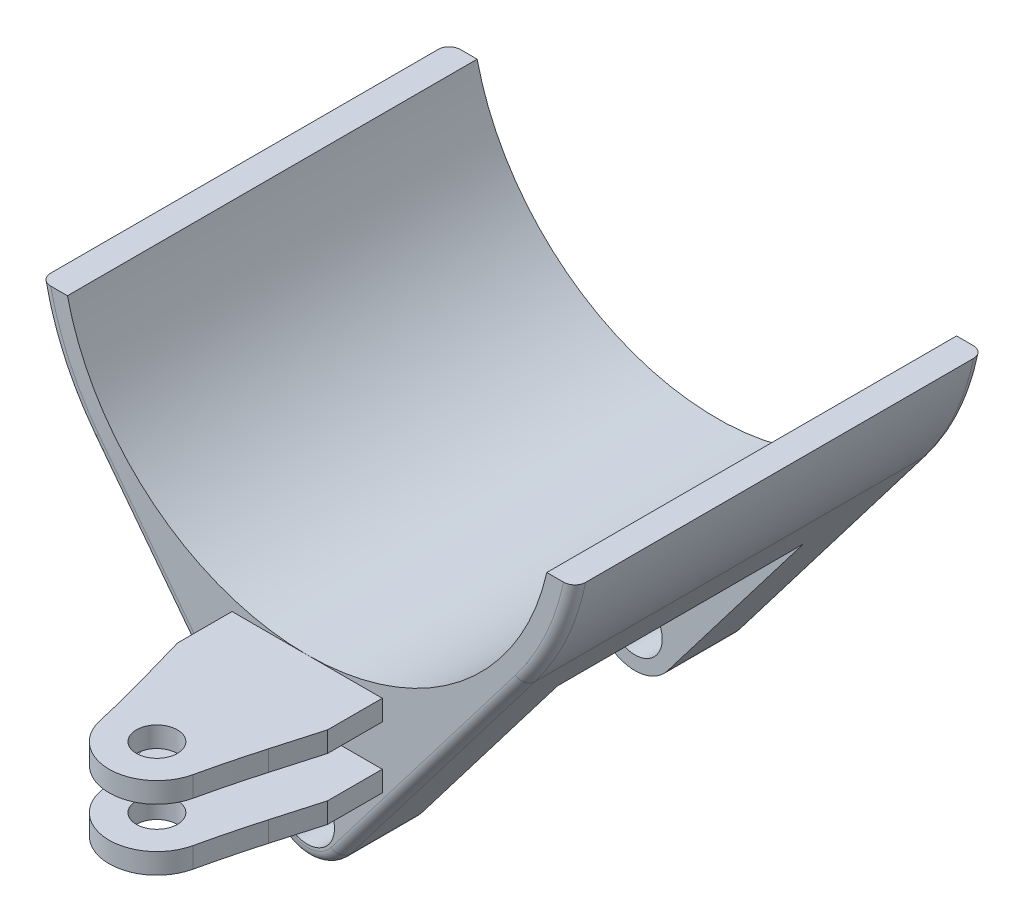
from build123d import *

# Parameters (mm, degrees)
SKETCH1_R             = 20
BOSS_EXTRUDE1_DEPTH   = 150
BOSS_EXTRUDE2_START   = 40
SKETCH2_R             = 15
BOSS_EXTRUDE2_DEPTH   = 60
SKETCH3_W             = 178.732333714
SKETCH3_H             = 30
CUT_EXTRUDE1_DEPTH    = 150
SKETCH4_W             = 180
SKETCH4_H             = 180.454063709
CUT_EXTRUDE2_DEPTH    = 170
CHAMFER1_SIZE         = 4
CHAMFER1_SIZE2        = 21.339042193
CHAMFER1_EDGE_2_SIZE  = 4
CHAMFER1_EDGE_2_SIZE2 = 21.339042193
FILLET1_R             = 4
FILLET2_R             = 8


with BuildPart() as part:
    # Sketch1 → Boss-Extrude1 (new, symmetric)
    with BuildSketch(Plane.XY):
        with BuildLine():
            Line((175.499287748, 240), (195.959179423, 240))
            ThreePointArc((195.959179423, 240), (182.049998135, 197.188176092), (158.918539009, 158.571428571))
            Line((158.918539009, 158.571428571), (23.837780851, -18.214285714))
            ThreePointArc((23.837780851, -18.214285714), (0, -30), (-23.837780851, -18.214285714))
            Line((-23.837780851, -18.214285714), (-158.918539009, 158.571428571))
            ThreePointArc((-158.918539009, 158.571428571), (-182.049998135, 197.188176092), (-195.959179423, 240))
            Line((-195.959179423, 240), (-175.499287748, 240))
            ThreePointArc((-175.499287748, 240), (0, 100), (175.499287748, 240))
        make_face()
        Circle(SKETCH1_R, mode=Mode.SUBTRACT)
    extrude(amount=BOSS_EXTRUDE1_DEPTH, both=True)

    # Sketch2 → Boss-Extrude2 (add)
    with BuildSketch(Plane(origin=(0, 0, 0), x_dir=(1, 0, 0), z_dir=(0, 1, 0)).offset(BOSS_EXTRUDE2_START)):
        with BuildLine():
            Line((0, -150), (55, -150))
            Line((55, -150), (55, -190))
            Line((55, -190), (45.381291361, -223.665480236))
            ThreePointArc((45.381291361, -223.665480236), (39.450512778, -245.597555378), (34.14492902, -267.689201664))
            ThreePointArc((34.14492902, -267.689201664), (0, -295), (-34.14492902, -267.689201664))
            ThreePointArc((-34.14492902, -267.689201664), (-39.450512778, -245.597555378), (-45.381291361, -223.665480236))
            Line((-45.381291361, -223.665480236), (-55, -190))
            Line((-55, -190), (-55, -150))
            Line((-55, -150), (0, -150))
        make_face()
        with Locations(Location((0, -260, 0), (0, 0, 270))):
            Circle(SKETCH2_R, mode=Mode.SUBTRACT)
    extrude(amount=BOSS_EXTRUDE2_DEPTH)

    # Sketch3 → Cut-Extrude1 (cut)
    with BuildSketch(Plane(origin=(55, 0, 0), x_dir=(0, 0, -1), z_dir=(1, 0, 0))):
        with Locations((-239.366166857, 70)):
            Rectangle(SKETCH3_W, SKETCH3_H)
    extrude(amount=-CUT_EXTRUDE1_DEPTH, mode=Mode.SUBTRACT)

    # Sketch4 → Cut-Extrude2 (cut, symmetric)
    with BuildSketch(Plane(origin=(0, 0, 0), x_dir=(0, 0, -1), z_dir=(1, 0, 0))):
        with Locations((0, 4.772968145)):
            Rectangle(SKETCH4_W, SKETCH4_H)
    extrude(amount=CUT_EXTRUDE2_DEPTH, both=True, mode=Mode.SUBTRACT)

    # Chamfer1
    chamfer1_edges = [part.edges().sort_by_distance(p)[0] for p in [
        (-110.344044156, 95, 0),
    ]]
    chamfer1_side = [part.faces().sort_by_distance(p)[0] for p in [
        (0, 95, 0),
    ]]
    chamfer(chamfer1_edges, length=CHAMFER1_SIZE, length2=CHAMFER1_SIZE2, reference=chamfer1_side[0])

    # Chamfer1 edge 2
    chamfer1_edge_2_edges = [part.edges().sort_by_distance(p)[0] for p in [
        (110.344044156, 95, 0),
    ]]
    chamfer1_edge_2_side = [part.faces().sort_by_distance(p)[0] for p in [
        (0, 95, 0),
    ]]
    chamfer(chamfer1_edge_2_edges, length=CHAMFER1_EDGE_2_SIZE, length2=CHAMFER1_EDGE_2_SIZE2, reference=chamfer1_edge_2_side[0])

    # Fillet1
    fillet1_edges = [part.edges().sort_by_distance(p)[0] for p in [
        (0, 95, 90),
        (0, 95, -90),
    ]]
    fillet(fillet1_edges, radius=FILLET1_R)

    # Fillet2
    fillet2_edges = [part.edges().sort_by_distance(p)[0] for p in [
        (182.049998135, 197.188176092, -150),
        (91.37815993, 70.178571429, -150),
        (0, -30, -150),
        (182.049998135, 197.188176092, 150),
        (-182.049998135, 197.188176092, 150),
        (-91.37815993, 70.178571429, 150),
        (0, -30, 150),
        (-91.37815993, 70.178571429, -150),
        (91.37815993, 70.178571429, 150),
        (-182.049998135, 197.188176092, -150),
    ]]
    fillet(fillet2_edges, radius=FILLET2_R)


solid = part.part
